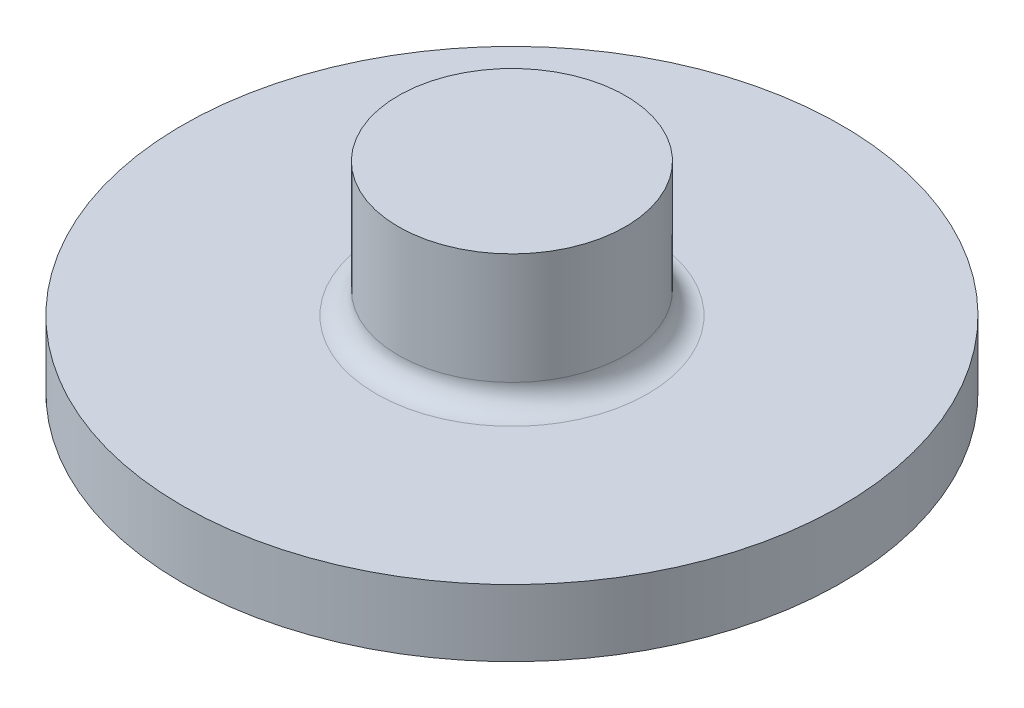
from build123d import *

# Parameters (mm, degrees)
SKETCH1_R           = 7.4
BOSS_EXTRUDE1_DEPTH = 1.5
SKETCH2_R           = 2.55
BOSS_EXTRUDE2_DEPTH = 3
FILLET1_R           = 0.5


with BuildPart() as part:
    # Sketch1 → Boss-Extrude1 (new body)
    with BuildSketch(Plane(origin=(0, 0, 0), x_dir=(1, 0, 0), z_dir=(0, 1, 0))):
        with Locations(Location((0, 0, 0), (0, 0, 270))):
            Circle(SKETCH1_R)
    extrude(amount=BOSS_EXTRUDE1_DEPTH)

    # Sketch2 → Boss-Extrude2 (add)
    with BuildSketch(Plane(origin=(0, 1.5, 0), x_dir=(1, 0, 0), z_dir=(0, 1, 0))):
        with Locations(Location((0, 0, 0), (0, 0, 270))):
            Circle(SKETCH2_R)
    extrude(amount=BOSS_EXTRUDE2_DEPTH)

    # Fillet1
    fillet1_edges = [part.edges().sort_by_distance(p)[0] for p in [
        (0, 1.5, -2.55),
    ]]
    fillet(fillet1_edges, radius=FILLET1_R)


solid = part.part
